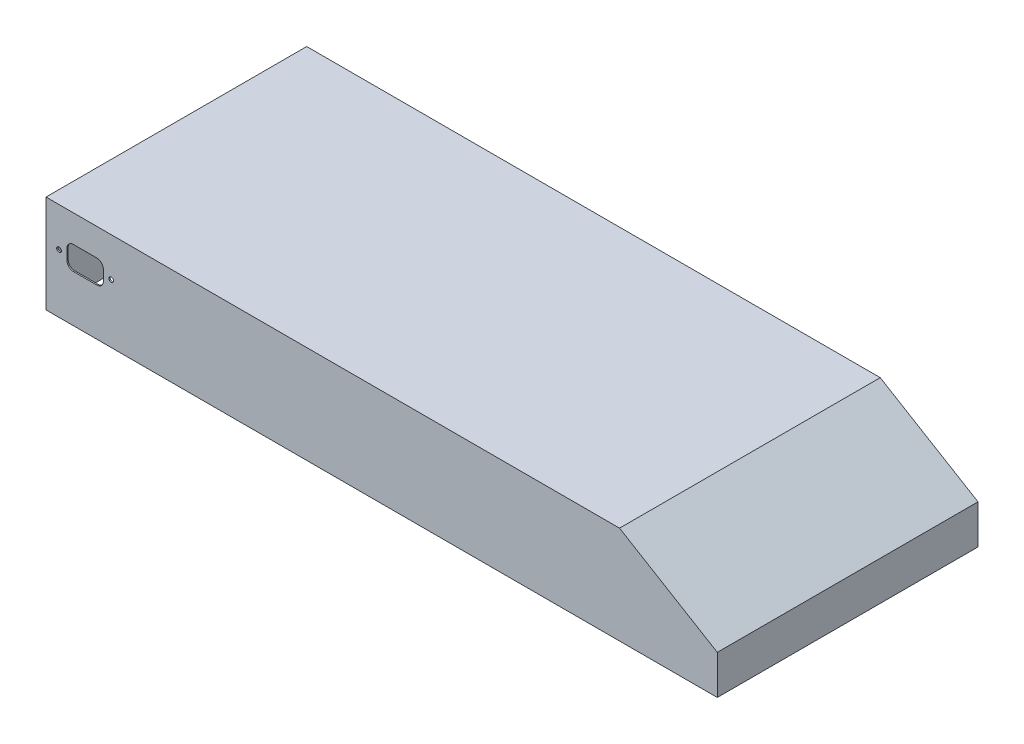
from build123d import *

# Parameters (mm, degrees)
BOSS_EXTRUDE1_DEPTH      = 100
SHELL1_T                 = -1
SKETCH2_W                = 28
SKETCH2_H                = 18
CUT_EXTRUDE1_DEPTH       = 1
FILLET1_R                = 5
M3_CLEARANCE_HOLE1_D     = 3.6
M3_CLEARANCE_HOLE1_DEPTH = 10
M3_CLEARANCE_HOLE1_TIP   = 1.081549114


with BuildPart() as part:
    # Sketch1 → Boss-Extrude1 (new, symmetric)
    with BuildSketch(Plane.XY):
        Polygon((0, 0), (515, 0), (515, 30), (440, 75), (0, 75), align=None)
    extrude(amount=BOSS_EXTRUDE1_DEPTH, both=True)

    # Shell1
    shell1_openings = [part.faces().sort_by_distance(p)[0] for p in [
        (257.5, 0, 0),
    ]]
    offset(amount=SHELL1_T, openings=shell1_openings, kind=Kind.INTERSECTION)

    # Sketch2 → Cut-Extrude1 (cut)
    with BuildSketch(Plane.XY.offset(100)):
        with Locations((30, 45)):
            Rectangle(SKETCH2_W, SKETCH2_H)
    extrude(amount=-CUT_EXTRUDE1_DEPTH, mode=Mode.SUBTRACT)

    # Fillet1
    fillet1_edges = [part.edges().sort_by_distance(p)[0] for p in [
        (16, 36, 99.5),
        (16, 54, 99.5),
        (44, 54, 99.5),
        (44, 36, 99.5),
    ]]
    fillet(fillet1_edges, radius=FILLET1_R)

    # M3 Clearance Hole1
    with Locations(Plane.XY.offset(100)):
        with Locations((10, 45.046525162), (50, 45.046525162)):
            Hole(M3_CLEARANCE_HOLE1_D / 2, depth=M3_CLEARANCE_HOLE1_DEPTH)
            with Locations((0, 0, -(M3_CLEARANCE_HOLE1_DEPTH + M3_CLEARANCE_HOLE1_TIP / 2))):  # 118° drill point
                Cone(0, M3_CLEARANCE_HOLE1_D / 2, M3_CLEARANCE_HOLE1_TIP, mode=Mode.SUBTRACT)


solid = part.part
